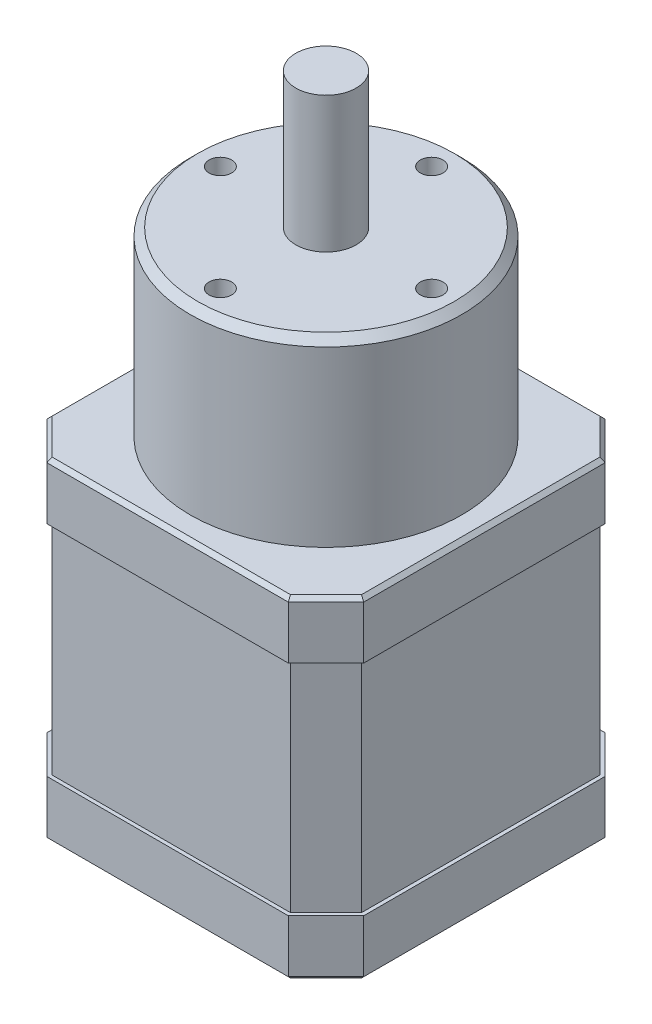
from build123d import *

# Parameters (mm, degrees)
SKETCH1_W           = 42
SKETCH1_H           = 42
BOSS_EXTRUDE1_DEPTH = 44
SKETCH2_R           = 18
BOSS_EXTRUDE2_DEPTH = 24
SKETCH3_R           = 4
BOSS_EXTRUDE3_DEPTH = 18
CHAMFER1_SIZE       = 5
SKETCH4_R           = 1.5
CUT_EXTRUDE1_DEPTH  = 10
CIRPATTERN1_COUNT   = 4
CHAMFER2_SIZE       = 1
CUT_EXTRUDE2_START  = -7.5
CUT_EXTRUDE2_DEPTH  = 29
CHAMFER4_SIZE       = 0.5


with BuildPart() as part:
    # Sketch1 → Boss-Extrude1 (new body)
    with BuildSketch(Plane(origin=(0, 0, 0), x_dir=(1, 0, 0), z_dir=(0, 1, 0))):
        Rectangle(SKETCH1_W, SKETCH1_H)
    extrude(amount=BOSS_EXTRUDE1_DEPTH)

    # Sketch2 → Boss-Extrude2 (add)
    with BuildSketch(Plane(origin=(0, 44, 0), x_dir=(1, 0, 0), z_dir=(0, 1, 0))):
        with Locations(Location((0, 0, 0), (0, 0, 270))):
            Circle(SKETCH2_R)
    extrude(amount=BOSS_EXTRUDE2_DEPTH)

    # Sketch3 → Boss-Extrude3 (add)
    with BuildSketch(Plane(origin=(0, 68, 0), x_dir=(1, 0, 0), z_dir=(0, 1, 0))):
        with Locations(Location((0, 0, 0), (0, 0, 270))):
            Circle(SKETCH3_R)
    extrude(amount=BOSS_EXTRUDE3_DEPTH)

    # Chamfer1
    chamfer1_edges = [part.edges().sort_by_distance(p)[0] for p in [
        (21, 22, 21),
        (-21, 22, 21),
        (-21, 22, -21),
        (21, 22, -21),
    ]]
    chamfer(chamfer1_edges, length=CHAMFER1_SIZE)

    # Sketch4 → Cut-Extrude1 (cut)
    with BuildSketch(Plane(origin=(0, 68, 0), x_dir=(1, 0, 0), z_dir=(0, 1, 0))):
        with Locations(Location((0, 14, 0), (0, 0, 270))):
            Circle(SKETCH4_R)
    cut_extrude1 = extrude(amount=-CUT_EXTRUDE1_DEPTH, mode=Mode.SUBTRACT)

    # CirPattern1: Cut-Extrude1 ×4 about axis
    cirpattern1_axis = Axis((0, 0, 0), (0, 1, 0))
    for i in range(1, CIRPATTERN1_COUNT):
        add(cut_extrude1.rotate(cirpattern1_axis, i * 360 / CIRPATTERN1_COUNT), mode=Mode.SUBTRACT)

    # Chamfer2
    chamfer2_edges = [part.edges().sort_by_distance(p)[0] for p in [
        (0, 68, -18),
    ]]
    chamfer(chamfer2_edges, length=CHAMFER2_SIZE)

    # Sketch5 → Cut-Extrude2 (cut)
    with BuildSketch(Plane.XZ.offset(CUT_EXTRUDE2_START)):
        Polygon((-21, 16), (-21, -16), (-16, -21), (16, -21), (21, -16), (21, 16), (16, 21), (-16, 21), align=None)
        Polygon((-20.5, 15.792893219), (-20.5, -15.792893219), (-15.792893219, -20.5), (15.792893219, -20.5), (20.5, -15.792893219), (20.5, 15.792893219), (15.792893219, 20.5), (-15.792893219, 20.5), align=None, mode=Mode.SUBTRACT)
    extrude(amount=-CUT_EXTRUDE2_DEPTH, mode=Mode.SUBTRACT)

    # Chamfer4
    chamfer4_edges = [part.edges().sort_by_distance(p)[0] for p in [
        (-21, 0, 0),
        (-21, 44, 0),
        (21, 0, 0),
        (0, 0, 21),
        (0, 0, -21),
        (-18.5, 0, 18.5),
        (18.5, 0, 18.5),
        (18.5, 0, -18.5),
        (-18.5, 0, -18.5),
        (0, 44, -21),
        (21, 44, 0),
        (0, 44, 21),
        (-18.5, 44, 18.5),
        (18.5, 44, 18.5),
        (18.5, 44, -18.5),
        (-18.5, 44, -18.5),
    ]]
    chamfer(chamfer4_edges, length=CHAMFER4_SIZE)


solid = part.part
